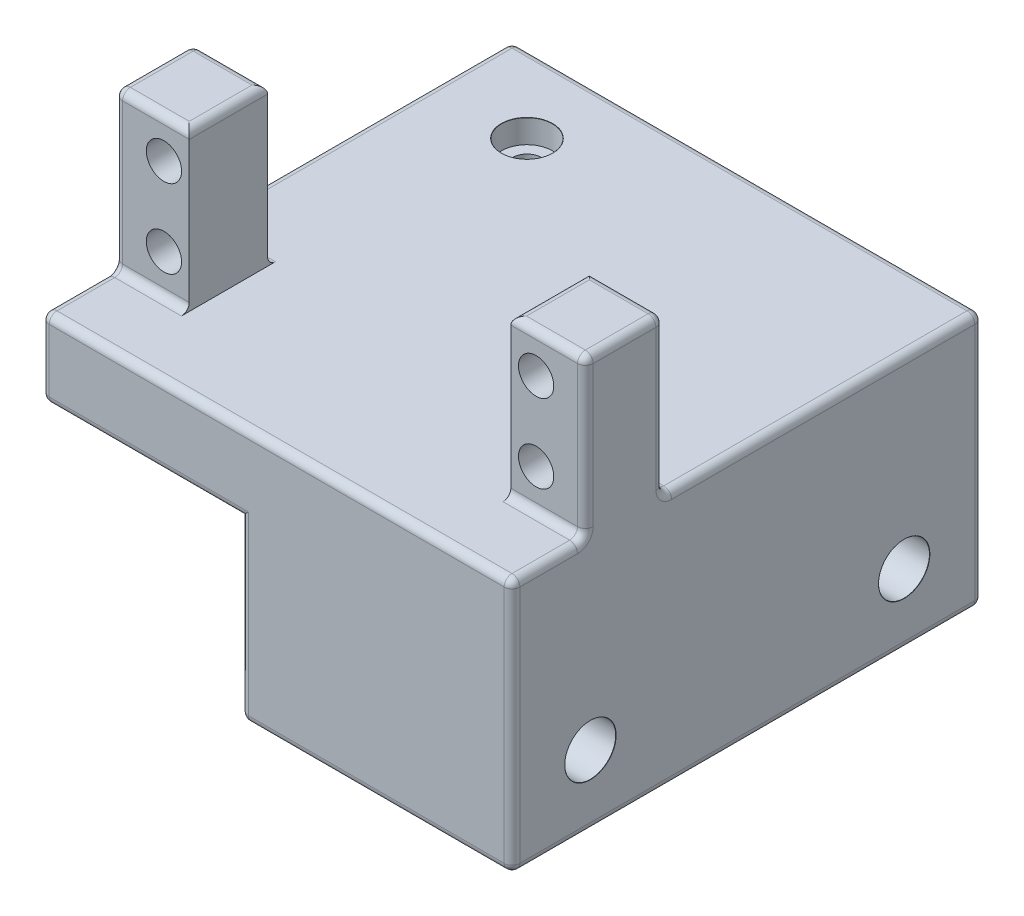
from build123d import *

# Parameters (mm, degrees)
SKETCH1_W                     = 60
SKETCH1_H                     = 60
BOSS_EXTRUDE1_DEPTH           = 10
SKETCH1_3_W                   = 9.5
SKETCH1_3_H                   = 10
BOSS_EXTRUDE2_DEPTH           = 20
BOSS_EXTRUDE3_START           = -10
SKETCH1_4_W                   = 34.6
SKETCH1_4_H                   = 60
BOSS_EXTRUDE3_DEPTH           = 22.5
CBORE_FOR_M3_SHCS1_AT_2_COUNT = 2
CBORE_FOR_M3_SHCS1_AT_2_PITCH = 40
SKETCH6_R                     = 2.25
CUT_EXTRUDE1_DEPTH            = 10
FILLET1_R                     = 1


with BuildPart() as part:
    # Sketch1 → Boss-Extrude1 (new body)
    with BuildSketch(Plane(origin=(0, 0, 0), x_dir=(1, 0, 0), z_dir=(0, 1, 0))):
        Rectangle(SKETCH1_W, SKETCH1_H)
    extrude(amount=-BOSS_EXTRUDE1_DEPTH)

    # Sketch1<3> → Boss-Extrude2 (add)
    with BuildSketch(Plane(origin=(0, 0, 0), x_dir=(1, 0, 0), z_dir=(0, 1, 0))):
        with Locations((-25.25, -15.65)):
            Rectangle(SKETCH1_3_W, SKETCH1_3_H)
        with Locations((25.25, -15.65)):
            Rectangle(SKETCH1_3_W, SKETCH1_3_H)
    extrude(amount=BOSS_EXTRUDE2_DEPTH)

    # Sketch1<4> → Boss-Extrude3 (add)
    with BuildSketch(Plane(origin=(0, 0, 0), x_dir=(1, 0, 0), z_dir=(0, 1, 0)).offset(BOSS_EXTRUDE3_START)):
        with Locations((12.7, 0)):
            Rectangle(SKETCH1_4_W, SKETCH1_4_H)
    extrude(amount=-BOSS_EXTRUDE3_DEPTH)

    # Sketch3 → CBORE for M3 SHCS1 (revolve, cut)
    with BuildSketch(Plane(origin=(30, -23.49, 20), x_dir=(0, 0, -1), z_dir=(0, 1, 0))):
        Polygon((0, 0), (0, 35.681549114), (1.8, 34.6), (1.8, 23), (3.25, 23), (3.25, 0.025), (3.275, 0), align=None)
    cbore_for_m3_shcs1 = revolve(axis=Axis((36.35, -23.49, 20), (-1, 0, 0)), mode=Mode.SUBTRACT)

    # CBORE for M3 SHCS1 at 2: CBORE for M3 SHCS1 ×2
    with Locations(*[(0, 0, -i * CBORE_FOR_M3_SHCS1_AT_2_PITCH) for i in range(1, CBORE_FOR_M3_SHCS1_AT_2_COUNT)]):
        add(cbore_for_m3_shcs1, mode=Mode.SUBTRACT)

    # Sketch5 → CBORE for M3 SHCS2 (revolve, cut)
    with BuildSketch(Plane(origin=(-18.09, 0, -20), x_dir=(0, 0, 1), z_dir=(1, 0, 0))):
        Polygon((0, 0), (0, 11.081549114), (1.8, 10), (1.8, 3), (3.25, 3), (3.25, 0.025), (3.275, 0), align=None)
    revolve(axis=Axis((-18.09, 6.35, -20), (0, -1, 0)), mode=Mode.SUBTRACT)

    # Sketch6 → Cut-Extrude1 (cut)
    with BuildSketch(Plane.XY.offset(20.65)):
        with Locations((-23.725, 15)):
            Circle(SKETCH6_R)
        with Locations((-23.725, 5)):
            Circle(SKETCH6_R)
        with Locations(Location((23.725, 5, 0), (0, 0, 180))):
            Circle(SKETCH6_R)
        with Locations(Location((23.725, 15, 0), (0, 0, 180))):
            Circle(SKETCH6_R)
    extrude(amount=-CUT_EXTRUDE1_DEPTH, mode=Mode.SUBTRACT)

    # Fillet1
    fillet1_edges = [part.edges().sort_by_distance(p)[0] for p in [
        (-17.3, -10, -30),
        (-30, -10, 0),
        (-30, 0, 25.325),
        (-25.25, 20, 20.65),
        (-30, 10, 20.65),
        (-20.5, 20, 15.65),
        (-25.25, 20, 10.65),
        (-30, 10, 10.65),
        (-30, 20, 15.65),
        (-25.25, 0, 20.65),
        (-25.25, 0, 10.65),
        (30, 0, 25.325),
        (30, 20, 15.65),
        (30, 10, 20.65),
        (25.25, 0, 10.65),
        (30, 10, 10.65),
        (25.25, 0, 20.65),
        (25.25, 20, 10.65),
        (20.5, 20, 15.65),
        (25.25, 20, 20.65),
        (-17.3, -10, 30),
        (-4.6, -32.5, 0),
        (-4.6, -21.25, 30),
        (-4.6, -21.25, -30),
        (12.7, -32.5, -30),
        (30, -32.5, 0),
        (12.7, -32.5, 30),
        (0, 0, 30),
        (-30, 0, -9.675),
        (0, 0, -30),
        (30, 0, -9.675),
        (30, -16.25, 30),
        (-30, -5, 30),
        (-30, -5, -30),
        (30, -16.25, -30),
    ]]
    fillet(fillet1_edges, radius=FILLET1_R)


solid = part.part
